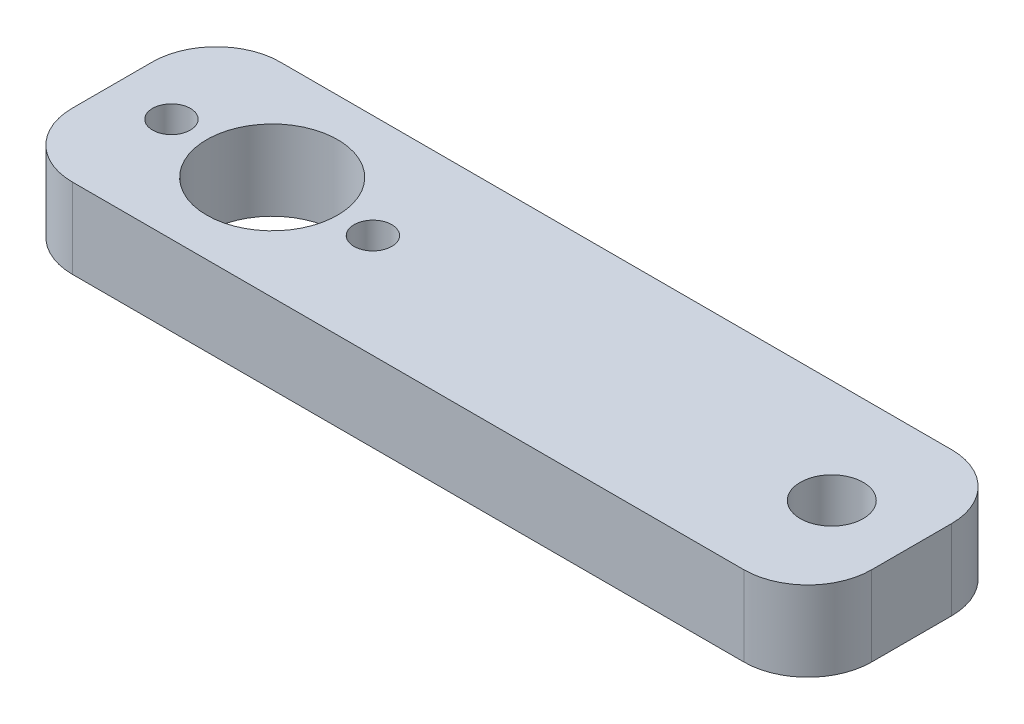
from build123d import *

# Parameters (mm, degrees)
SKETCH1_W              = 63.5
SKETCH1_H              = 16.51
BOSS_EXTRUDE1_DEPTH    = 6.35
F_5_0MM_DOWEL_HOLE1_D  = 5
F_10_0MM_DOWEL_HOLE1_D = 10.4
F_3_0MM_DOWEL_HOLE1_D  = 3
FILLET1_R              = 5.08


with BuildPart() as part:
    # Sketch1 → Boss-Extrude1 (new body)
    with BuildSketch(Plane(origin=(0, 0, 0), x_dir=(1, 0, 0), z_dir=(0, 1, 0))):
        with Locations((31.75, 8.255)):
            Rectangle(SKETCH1_W, SKETCH1_H)
    extrude(amount=BOSS_EXTRUDE1_DEPTH)

    # Ø5.0mm Dowel Hole1 (through all)
    with Locations(Plane(origin=(0, 6.35, 0), x_dir=(1, 0, 0), z_dir=(0, 1, 0))):
        with Locations((57.15, 8.255)):
            Hole(F_5_0MM_DOWEL_HOLE1_D / 2)

    # Ø10.0mm Dowel Hole1 (through all)
    with Locations(Plane(origin=(12.7, 6.35, -8.255), x_dir=(0, 0, 1), z_dir=(0, 1, 0))):
        with Locations((0, 0)):
            Hole(F_10_0MM_DOWEL_HOLE1_D / 2)

    # Ø3.0mm Dowel Hole1 (through all)
    with Locations(Plane(origin=(0, 6.35, 0), x_dir=(1, 0, 0), z_dir=(0, 1, 0))):
        with Locations((4.699, 8.255), (20.701, 8.255)):
            Hole(F_3_0MM_DOWEL_HOLE1_D / 2)

    # Fillet1
    fillet1_edges = [part.edges().sort_by_distance(p)[0] for p in [
        (0, 3.175, -16.51),
        (63.5, 3.175, -16.51),
        (63.5, 3.175, 0),
        (0, 3.175, 0),
    ]]
    fillet(fillet1_edges, radius=FILLET1_R)


solid = part.part
